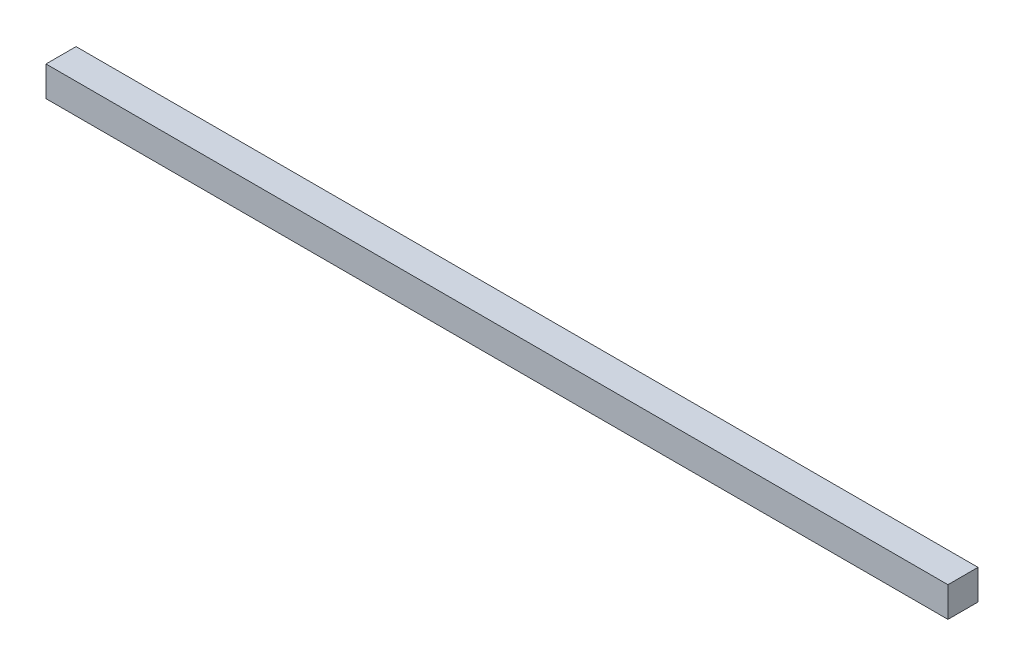
from build123d import *

# Parameters (mm, degrees)
SKETCH1_W           = 1143
SKETCH1_H           = 38.1
BOSS_EXTRUDE1_DEPTH = 38.1


with BuildPart() as part:
    # Sketch1 → Boss-Extrude1 (new body)
    with BuildSketch(Plane.XY):
        Rectangle(SKETCH1_W, SKETCH1_H)
    extrude(amount=BOSS_EXTRUDE1_DEPTH)


solid = part.part
